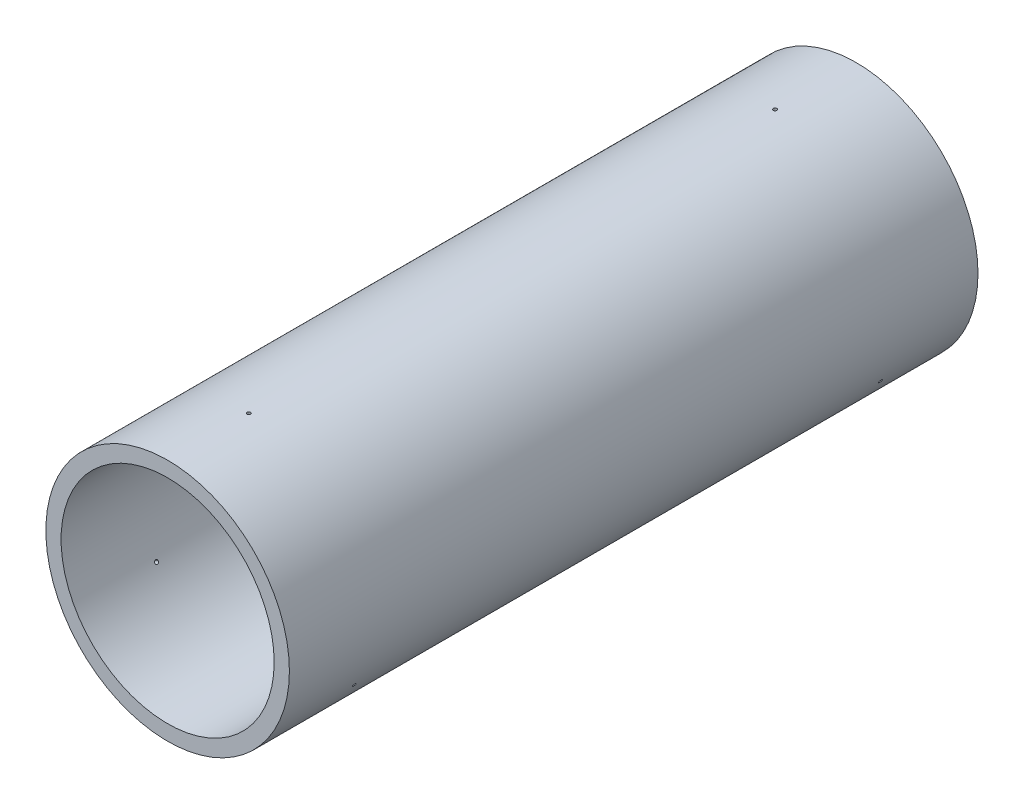
from build123d import *

# Parameters (mm, degrees)
SKETCH1_R                  = 76.1746
SKETCH1_R_2                = 66.6496
BOSS_EXTRUDE1_DEPTH        = 215.3793
F_4_40_TAPPED_HOLE1_REACH  = 418.391
F_4_40_TAPPED_HOLE1_BORE_R = 1.1303
CIRPATTERN1_COUNT          = 3
MIRROR1_COPY_1_REACH       = 418.391
MIRROR1_COPY_1_SKETCH_R    = 1.1303
MIRROR1_COPY_2_REACH       = 418.391
MIRROR1_COPY_2_SKETCH_R    = 1.1303


with BuildPart() as part:
    # Sketch1 → Boss-Extrude1 (new, symmetric)
    with BuildSketch(Plane.XY):
        Circle(SKETCH1_R)
        Circle(SKETCH1_R_2, mode=Mode.SUBTRACT)
    extrude(amount=BOSS_EXTRUDE1_DEPTH, both=True)

    # #4-40 Tapped Hole1 bore (on position points) → #4-40 Tapped Hole1 (cut, up to next)
    with BuildSketch(Plane(origin=(0, 76.1746, 164.5793), x_dir=(1, 0, 0), z_dir=(0, 1, 0)), mode=Mode.PRIVATE) as f_4_40_tapped_hole1_sk1:
        Circle(F_4_40_TAPPED_HOLE1_BORE_R)
    f_4_40_tapped_hole1_tool1 = extrude(f_4_40_tapped_hole1_sk1.sketch, amount=-F_4_40_TAPPED_HOLE1_REACH, mode=Mode.PRIVATE) & part.part
    f_4_40_tapped_hole1 = f_4_40_tapped_hole1_tool1.solids().sort_by_distance((0, 76.1746, 164.5793))[0]
    add(f_4_40_tapped_hole1, mode=Mode.SUBTRACT)

    # CirPattern1: #4-40 Tapped Hole1 ×3 about axis
    cirpattern1_axis = Axis((0, 0, 215.3793), (0, 0, 1))
    for i in range(1, CIRPATTERN1_COUNT):
        add(f_4_40_tapped_hole1.rotate(cirpattern1_axis, i * 360 / CIRPATTERN1_COUNT), mode=Mode.SUBTRACT)

    # Mirror1: #4-40 Tapped Hole1 across plane
    add(f_4_40_tapped_hole1.mirror(Plane.XY), mode=Mode.SUBTRACT)

    # Mirror1 copy 1 sketch → Mirror1 copy 1 (cut, up to next)
    with BuildSketch(Plane(origin=(-65.969138723, -38.0873, -164.5793), x_dir=(-0.4999999999999998, 0.8660254037844387, 0), z_dir=(-0.8660254037844387, -0.4999999999999998, 0)), mode=Mode.PRIVATE) as mirror1_copy_1_sk1:
        Circle(MIRROR1_COPY_1_SKETCH_R)
    mirror1_copy_1_tool1 = extrude(mirror1_copy_1_sk1.sketch, amount=-MIRROR1_COPY_1_REACH, mode=Mode.PRIVATE) & part.part
    add(mirror1_copy_1_tool1.solids().sort_by_distance((-65.969138723, -38.0873, -164.5793))[0], mode=Mode.SUBTRACT)

    # Mirror1 copy 2 sketch → Mirror1 copy 2 (cut, up to next)
    with BuildSketch(Plane(origin=(65.969138723, -38.0873, -164.5793), x_dir=(-0.5000000000000004, -0.8660254037844384, 0), z_dir=(0.8660254037844384, -0.5000000000000004, 0)), mode=Mode.PRIVATE) as mirror1_copy_2_sk1:
        Circle(MIRROR1_COPY_2_SKETCH_R)
    mirror1_copy_2_tool1 = extrude(mirror1_copy_2_sk1.sketch, amount=-MIRROR1_COPY_2_REACH, mode=Mode.PRIVATE) & part.part
    add(mirror1_copy_2_tool1.solids().sort_by_distance((65.969138723, -38.0873, -164.5793))[0], mode=Mode.SUBTRACT)


solid = part.part
